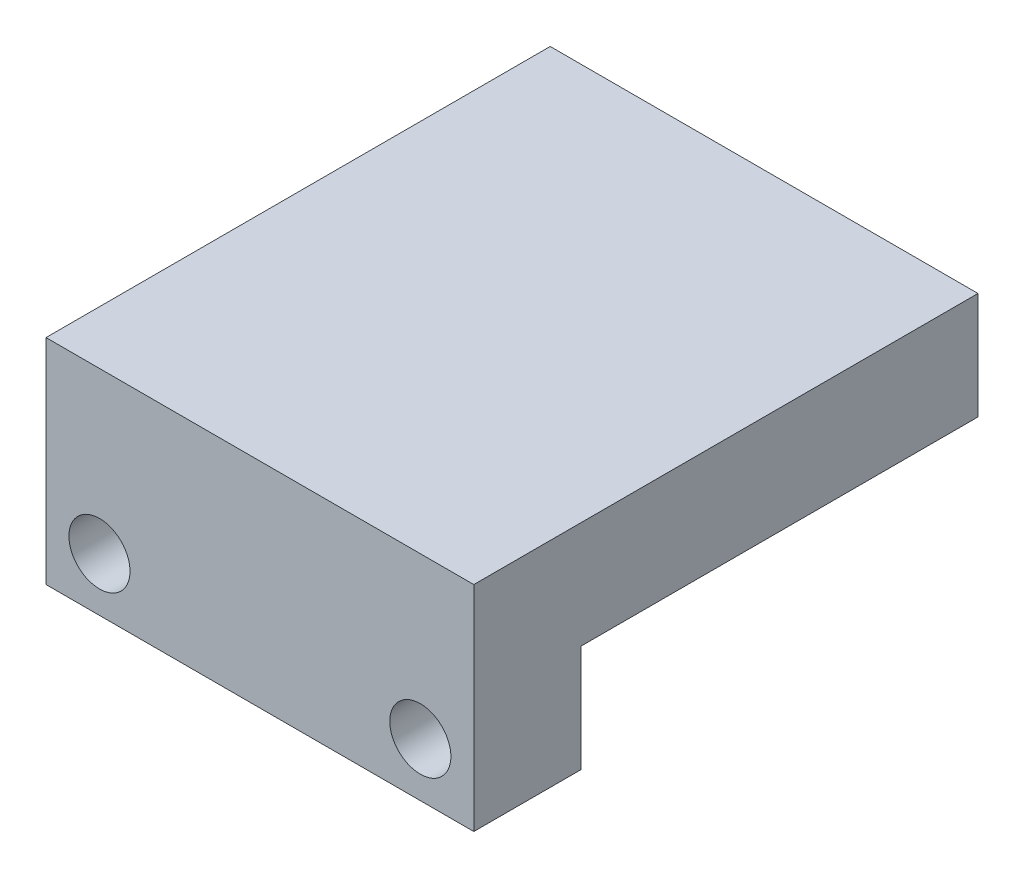
from build123d import *

# Parameters (mm, degrees)
SKETCH1_W           = 28
SKETCH1_H           = 28
SKETCH1_R           = 9
BOSS_EXTRUDE3_DEPTH = 5
SKETCH1_4_W         = 28
SKETCH1_4_H         = 33
BOSS_EXTRUDE4_DEPTH = 2
SKETCH1_5_W         = 28
SKETCH1_5_H         = 5
BOSS_EXTRUDE5_DEPTH = 12
SKETCH2_R           = 2
CUT_EXTRUDE1_DEPTH  = 34.526109228
BOSS_EXTRUDE6_START = 2
SKETCH2_3_W         = 28
SKETCH2_3_H         = 7
SKETCH2_3_R         = 2
BOSS_EXTRUDE6_DEPTH = 2


with BuildPart() as part:
    # Sketch1 → Boss-Extrude3 (new body)
    with BuildSketch(Plane(origin=(0, 0, 0), x_dir=(1, 0, 0), z_dir=(0, 1, 0))):
        Rectangle(SKETCH1_W, SKETCH1_H)
        Circle(SKETCH1_R, mode=Mode.SUBTRACT)
    extrude(amount=-BOSS_EXTRUDE3_DEPTH)

    # Sketch1<4> → Boss-Extrude4 (add)
    with BuildSketch(Plane(origin=(0, 0, 0), x_dir=(1, 0, 0), z_dir=(0, 1, 0))):
        with Locations((0, -2.5)):
            Rectangle(SKETCH1_4_W, SKETCH1_4_H)
    extrude(amount=BOSS_EXTRUDE4_DEPTH)

    # Sketch1<5> → Boss-Extrude5 (add)
    with BuildSketch(Plane(origin=(0, 0, 0), x_dir=(1, 0, 0), z_dir=(0, 1, 0))):
        with Locations((0, -16.5)):
            Rectangle(SKETCH1_5_W, SKETCH1_5_H)
    extrude(amount=-BOSS_EXTRUDE5_DEPTH)

    # Sketch2 → Cut-Extrude1 (cut, through all)
    with BuildSketch(Plane(origin=(0, 0, 14), x_dir=(-1, 0, 0), z_dir=(0, 0, -1))):
        with Locations((-10.5, -8.5)):
            Circle(SKETCH2_R)
        with Locations((10.5, -8.5)):
            Circle(SKETCH2_R)
    extrude(amount=-CUT_EXTRUDE1_DEPTH, mode=Mode.SUBTRACT)

    # Sketch2<3> → Boss-Extrude6 (add)
    with BuildSketch(Plane(origin=(0, 0, 14), x_dir=(-1, 0, 0), z_dir=(0, 0, -1)).offset(BOSS_EXTRUDE6_START)):
        with Locations((0, -8.5)):
            Rectangle(SKETCH2_3_W, SKETCH2_3_H)
        with Locations((-10.5, -8.5)):
            Circle(SKETCH2_3_R, mode=Mode.SUBTRACT)
        with Locations((10.5, -8.5)):
            Circle(SKETCH2_3_R, mode=Mode.SUBTRACT)
    extrude(amount=-BOSS_EXTRUDE6_DEPTH)


solid = part.part
